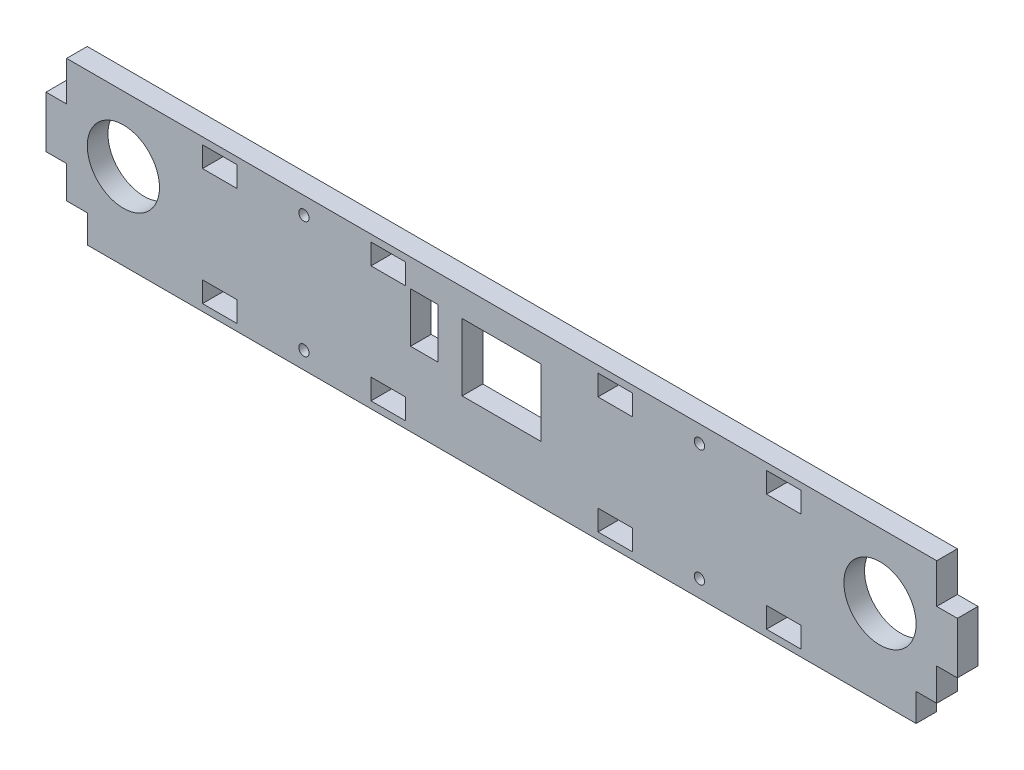
from build123d import *

# Parameters (mm, degrees)
SKETCH_1_R      = 1.5
SKETCH_1_R_2    = 10.5
SKETCH_1_W      = 10
SKETCH_1_H      = 6
SKETCH_1_W_2    = 8
SKETCH_1_H_2    = 14.5
SKETCH_1_W_3    = 23
SKETCH_1_H_3    = 19.5
EXTRUDE_1_DEPTH = 6


with BuildPart() as part:
    # Эскиз1 → Бобышка-Вытянуть1 (new body)
    with BuildSketch(Plane.XY):
        Polygon((-126.5, 22), (-126.5, 10.5), (-132.5, 10.5), (-132.5, -4.5), (-126.5, -4.5), (-126.5, -13.9), (-120.5, -13.9), (-120.5, -22), (120.5, -22), (120.5, -13.9), (126.5, -13.9), (126.5, -4.5), (132.5, -4.5), (132.5, 10.5), (126.5, 10.5), (126.5, 22), align=None)
        with Locations((57.5, 17)):
            Circle(SKETCH_1_R, mode=Mode.SUBTRACT)
        with Locations((110, 3)):
            Circle(SKETCH_1_R_2, mode=Mode.SUBTRACT)
        with Locations((57.5, -17)):
            Circle(SKETCH_1_R, mode=Mode.SUBTRACT)
        with Locations((-57.5, 17)):
            Circle(SKETCH_1_R, mode=Mode.SUBTRACT)
        with Locations((-110, 3)):
            Circle(SKETCH_1_R_2, mode=Mode.SUBTRACT)
        with Locations((-57.5, -17)):
            Circle(SKETCH_1_R, mode=Mode.SUBTRACT)
        with Locations((33, 17)):
            Rectangle(SKETCH_1_W, SKETCH_1_H, mode=Mode.SUBTRACT)
        with Locations((82, 17)):
            Rectangle(SKETCH_1_W, SKETCH_1_H, mode=Mode.SUBTRACT)
        with Locations((33, -17)):
            Rectangle(SKETCH_1_W, SKETCH_1_H, mode=Mode.SUBTRACT)
        with Locations((82, -17)):
            Rectangle(SKETCH_1_W, SKETCH_1_H, mode=Mode.SUBTRACT)
        with Locations((-33, 17)):
            Rectangle(SKETCH_1_W, SKETCH_1_H, mode=Mode.SUBTRACT)
        with Locations((-82, 17)):
            Rectangle(SKETCH_1_W, SKETCH_1_H, mode=Mode.SUBTRACT)
        with Locations((-33, -17)):
            Rectangle(SKETCH_1_W, SKETCH_1_H, mode=Mode.SUBTRACT)
        with Locations((-82, -17)):
            Rectangle(SKETCH_1_W, SKETCH_1_H, mode=Mode.SUBTRACT)
        with Locations((-22.5, 6.749994)):
            Rectangle(SKETCH_1_W_2, SKETCH_1_H_2, mode=Mode.SUBTRACT)
        with Locations((2e-06, 4.249994)):
            Rectangle(SKETCH_1_W_3, SKETCH_1_H_3, mode=Mode.SUBTRACT)
    extrude(amount=EXTRUDE_1_DEPTH)


solid = part.part
